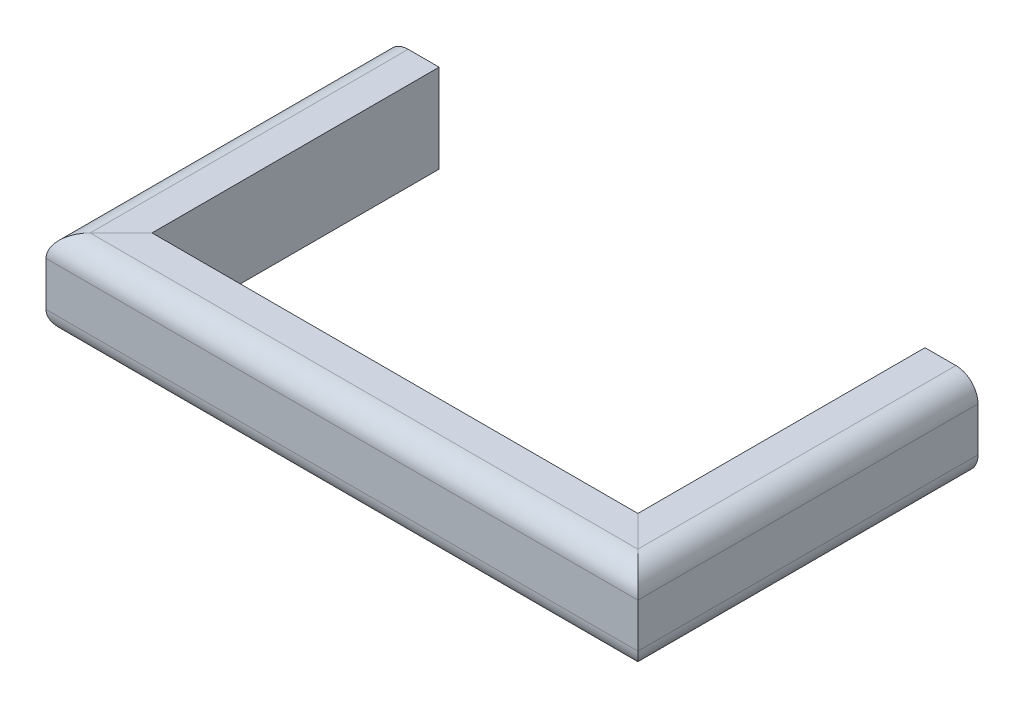
from build123d import *

# Parameters (mm, degrees)
SKETCH4_R          = 3.175
CUT_EXTRUDE1_DEPTH = 12.7


with BuildPart() as part:
    # Sweep1: sweep along a path in Sketch3
    with BuildLine(Plane(origin=(0, 0, 0), x_dir=(1, 0, 0), z_dir=(0, 1, 0))) as sweep1_path:
        Line((349.25, 0), (349.25, -412.75))
        Line((349.25, -412.75), (-349.25, -412.75))
        Line((-349.25, -412.75), (-349.25, 0))
    # Sketch2 → Sweep1 (sweep)
    with BuildSketch(Plane.XY):
        with BuildLine():
            Line((-349.25, 63.5), (-393.7, 63.5))
            ThreePointArc((-393.7, 63.5), (-416.150640303, 54.200640303), (-425.45, 31.75))
            Line((-425.45, 31.75), (-425.45, -31.75))
            ThreePointArc((-425.45, -31.75), (-416.150640303, -54.200640303), (-393.7, -63.5))
            Line((-393.7, -63.5), (-349.25, -63.5))
            Line((-349.25, -63.5), (-349.25, 63.5))
        make_face()
    sweep(path=sweep1_path.line, transition=Transition.RIGHT)

    # Sketch4 → Cut-Extrude1 (cut)
    with BuildSketch(Plane(origin=(0, 0, 412.75), x_dir=(-1, 0, 0), z_dir=(0, 0, -1))):
        with Locations((-342.9, 50.8)):
            Circle(SKETCH4_R)
        with Locations((-330.2, 50.8)):
            Circle(SKETCH4_R)
        with Locations(Location((330.2, 50.8, 0), (0, 0, 180))):
            Circle(SKETCH4_R)
        with Locations(Location((342.9, 50.8, 0), (0, 0, 180))):
            Circle(SKETCH4_R)
    extrude(amount=-CUT_EXTRUDE1_DEPTH, mode=Mode.SUBTRACT)


solid = part.part
